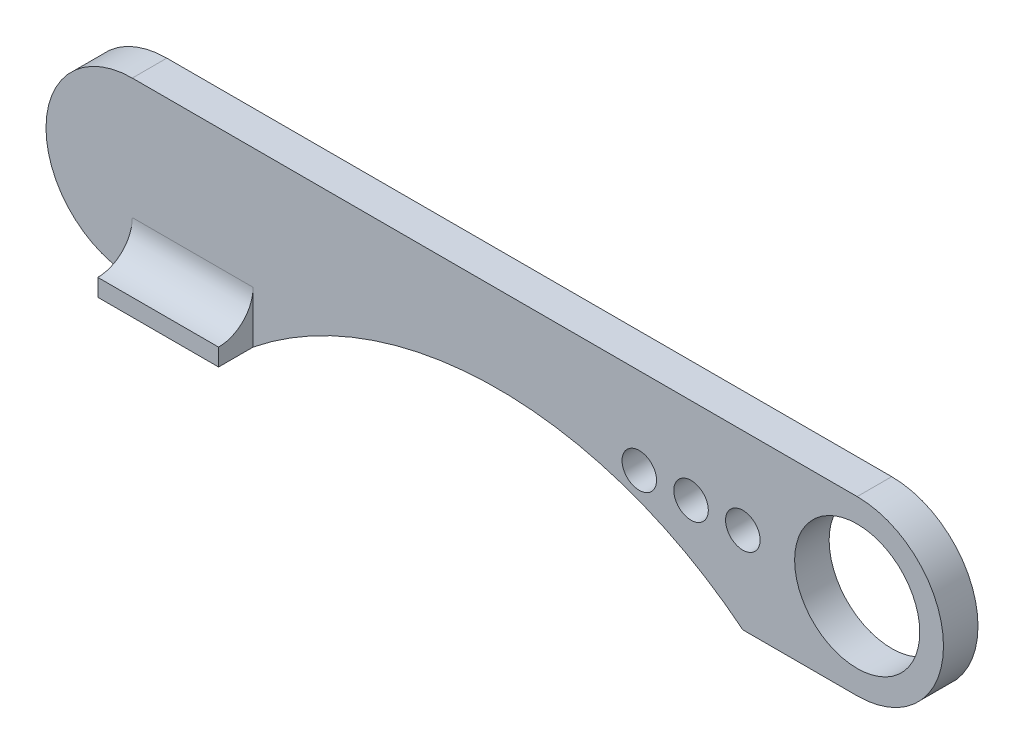
from build123d import *

# Parameters (mm, degrees)
BOSS_EXTRUDE1_DEPTH = 2
SKETCH3_R           = 3.625
SKETCH3_R_2         = 1
CUT_EXTRUDE1_DEPTH  = 2
SKETCH4_W           = 7
SKETCH4_H           = 4
BOSS_EXTRUDE2_DEPTH = 3
SKETCH7_R           = 2
CUT_EXTRUDE2_DEPTH  = 7


with BuildPart() as part:
    # Sketch1 → Boss-Extrude1 (new body)
    with BuildSketch(Plane.XY):
        with BuildLine():
            Line((-42, 5), (0, 5))
            ThreePointArc((0, 5), (5, 0), (0, -5))
            Line((0, -5), (-42, -5))
            ThreePointArc((-42, -5), (-47, 0), (-42, 5))
        make_face()
    extrude(amount=BOSS_EXTRUDE1_DEPTH)

    # Sketch3 → Cut-Extrude1 (cut)
    with BuildSketch(Plane(origin=(0, 0, 0), x_dir=(-1, 0, 0), z_dir=(0, 0, -1))):
        with BuildLine():
            Line((6.625, -5), (35, -5))
            ThreePointArc((35, -5), (20.8125, 0), (6.625, -5))
        make_face()
        Circle(SKETCH3_R)
        with Locations((6.625, 0)):
            Circle(SKETCH3_R_2)
        with Locations((9.625, 0)):
            Circle(SKETCH3_R_2)
        with Locations((12.625, 0)):
            Circle(SKETCH3_R_2)
    extrude(amount=-CUT_EXTRUDE1_DEPTH, mode=Mode.SUBTRACT)

    # Sketch4 → Boss-Extrude2 (add)
    with BuildSketch(Plane.XZ.offset(5)):
        with Locations((-38.5, 2)):
            Rectangle(SKETCH4_W, SKETCH4_H)
    extrude(amount=-BOSS_EXTRUDE2_DEPTH)

    # Sketch7 → Cut-Extrude2 (cut)
    with BuildSketch(Plane.ZY.offset(42)):
        with Locations((4, -2)):
            Circle(SKETCH7_R)
    extrude(amount=-CUT_EXTRUDE2_DEPTH, mode=Mode.SUBTRACT)


solid = part.part
